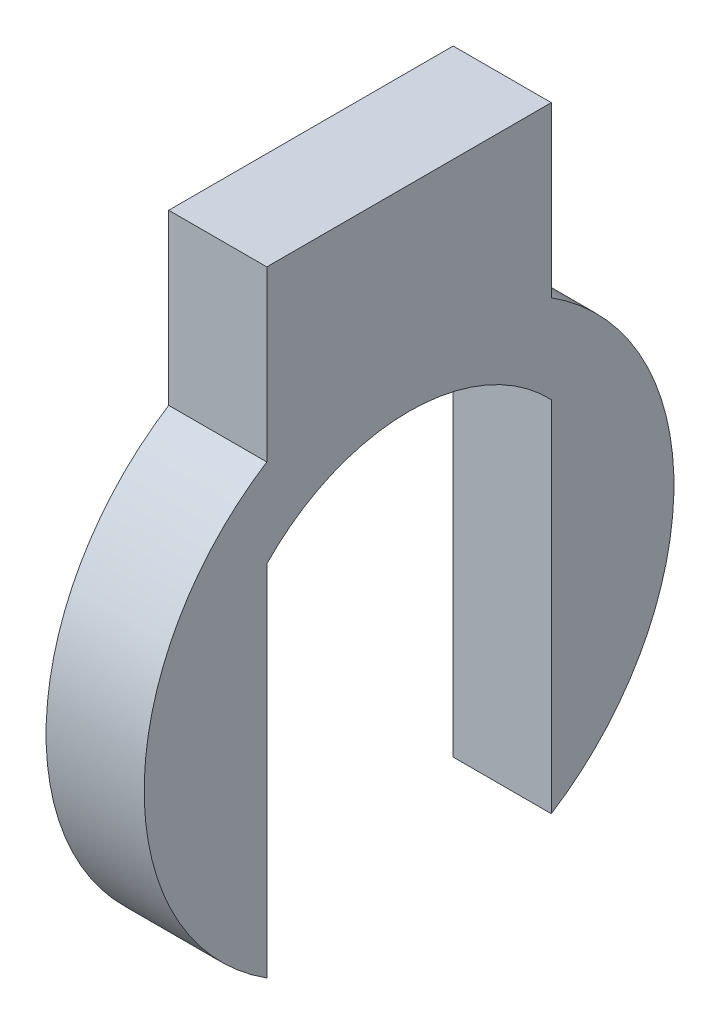
from build123d import *

# Parameters (mm, degrees)
BOSS_EXTRUDE1_DEPTH = 2.54


with BuildPart() as part:
    # Sketch1 → Boss-Extrude1 (new body)
    with BuildSketch(Plane(origin=(0, 0, 0), x_dir=(0, 0, -1), z_dir=(1, 0, 0))):
        with BuildLine():
            Line((-3.683, -5.785125323), (-3.683, 3.498844238))
            ThreePointArc((-3.683, 3.498844238), (0, 5.08), (3.683, 3.498844238))
            Line((3.683, 3.498844238), (3.683, -5.785125323))
            ThreePointArc((3.683, -5.785125323), (6.858, 0), (3.683, 5.785125323))
            Line((3.683, 5.785125323), (3.683, 10.16))
            Line((3.683, 10.16), (-3.683, 10.16))
            Line((-3.683, 10.16), (-3.683, 5.785125323))
            ThreePointArc((-3.683, 5.785125323), (-6.858, 0), (-3.683, -5.785125323))
        make_face()
    extrude(amount=BOSS_EXTRUDE1_DEPTH)


solid = part.part
